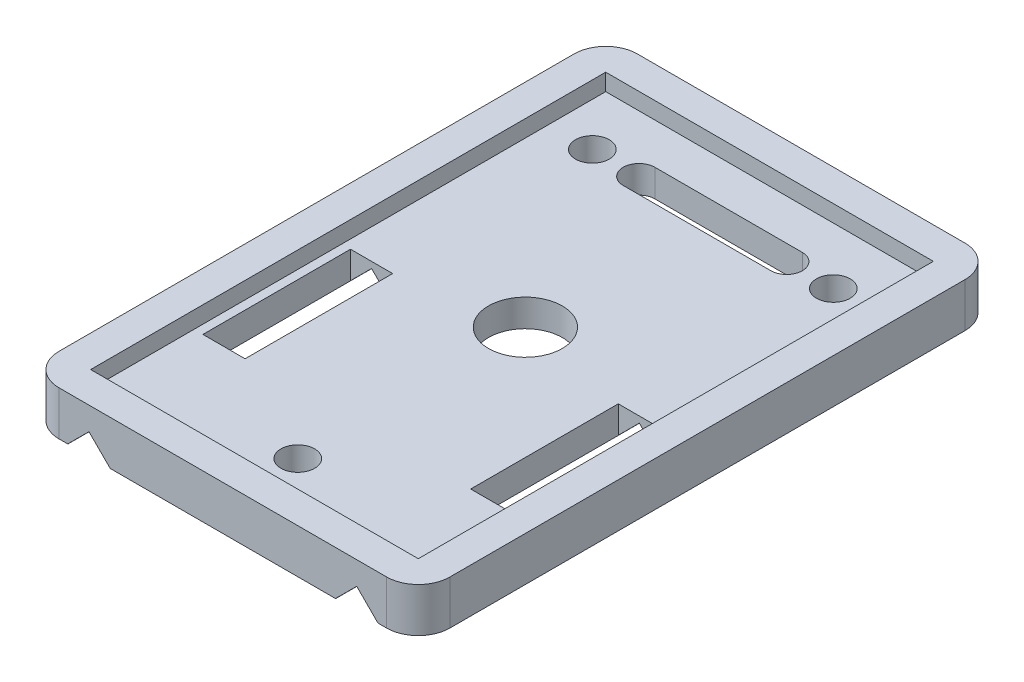
from build123d import *

# Parameters (mm, degrees)
BOSS_EXTRUDE1_DEPTH     = 4.2
CUT_EXTRUDE4_DEPTH      = 62.783185415
CUT_EXTRUDE4_DEPTH_BACK = 62.783185415
SKETCH2_R               = 1.6
SKETCH3_W               = 4
SKETCH3_H               = 14
CUT_EXTRUDE5_DEPTH      = 62.783185415
SKETCH6_W               = 31.08
SKETCH6_H               = 48.86
CUT_EXTRUDE6_DEPTH      = 1.6
CUT_EXTRUDE7_DEPTH      = 65.562744675
CUT_EXTRUDE7_DEPTH_BACK = 35
CUT_EXTRUDE8_DEPTH      = 62.695072737
CUT_EXTRUDE8_DEPTH_BACK = 62.695072737
SKETCH9_R               = 3.5


with BuildPart() as part:
    # Sketch1 → Boss-Extrude1 (new body)
    with BuildSketch(Plane(origin=(0, 0, 0), x_dir=(1, 0, 0), z_dir=(0, 1, 0))):
        with BuildLine():
            Line((-3.3, -0.3), (-3.3, 48.56))
            ThreePointArc((-3.3, 48.56), (-2.421320344, 50.681320344), (-0.3, 51.56))
            Line((-0.3, 51.56), (30.78, 51.56))
            ThreePointArc((30.78, 51.56), (32.901320344, 50.681320344), (33.78, 48.56))
            Line((33.78, 48.56), (33.78, -0.3))
            ThreePointArc((33.78, -0.3), (32.901320344, -2.421320344), (30.78, -3.3))
            Line((30.78, -3.3), (-0.3, -3.3))
            ThreePointArc((-0.3, -3.3), (-2.421320344, -2.421320344), (-3.3, -0.3))
        make_face()
    extrude(amount=BOSS_EXTRUDE1_DEPTH)

    # Sketch2 → Cut-Extrude4 (cut, two sides: drawn at the far end of the back side and taken through both)
    with BuildSketch(Plane(origin=(0, 0, 0), x_dir=(1, 0, 0), z_dir=(0, 1, 0)).offset(-CUT_EXTRUDE4_DEPTH_BACK)):
        with Locations(Location((3.81, 43.18, 0), (0, 0, 270))):
            Circle(SKETCH2_R)
        with Locations(Location((26.67, 43.18, 0), (0, 0, 270))):
            Circle(SKETCH2_R)
        with Locations(Location((15.24, 3.81, 0), (0, 0, 270))):
            Circle(SKETCH2_R)
    extrude(amount=CUT_EXTRUDE4_DEPTH + CUT_EXTRUDE4_DEPTH_BACK, mode=Mode.SUBTRACT)

    # Sketch3 → Cut-Extrude5 (cut, through all)
    with BuildSketch(Plane(origin=(0, 0, 0), x_dir=(1, 0, 0), z_dir=(0, 1, 0))):
        with Locations((2.54, 16.51)):
            Rectangle(SKETCH3_W, SKETCH3_H)
        with Locations((27.94, 16.51)):
            Rectangle(SKETCH3_W, SKETCH3_H)
    extrude(amount=CUT_EXTRUDE5_DEPTH, mode=Mode.SUBTRACT)

    # Sketch6 → Cut-Extrude6 (cut)
    with BuildSketch(Plane(origin=(0, 4.2, 0), x_dir=(1, 0, 0), z_dir=(0, 1, 0))):
        with Locations((15.24, 24.13)):
            Rectangle(SKETCH6_W, SKETCH6_H)
    extrude(amount=-CUT_EXTRUDE6_DEPTH, mode=Mode.SUBTRACT)

    # Sketch8 → Cut-Extrude7 (cut, two sides: drawn at the far end of the back side and taken through both)
    with BuildSketch(Plane.XY.offset(3.3).offset(-CUT_EXTRUDE7_DEPTH_BACK)):
        with BuildLine():
            ThreePointArc((1.74, 0), (1.542515791, 0.67088902), (1.832893219, 1.307106781))
            Line((1.832893219, 1.307106781), (0.54, 0.014213562))
            Line((0.54, 0.014213562), (0.54, 0))
            Line((0.54, 0), (1.74, 0))
        make_face()
        with BuildLine():
            ThreePointArc((1.832893219, 1.307106781), (2.54, 1.6), (3.247106781, 1.307106781))
            Line((3.247106781, 1.307106781), (2.54, 2.014213562))
            Line((2.54, 2.014213562), (1.832893219, 1.307106781))
        make_face()
        with BuildLine():
            ThreePointArc((3.54, 0.6), (3.463879533, 0.982683432), (3.247106781, 1.307106781))
            ThreePointArc((3.247106781, 1.307106781), (2.54, 1.6), (1.832893219, 1.307106781))
            ThreePointArc((1.832893219, 1.307106781), (1.542515791, 0.67088902), (1.74, 0))
            Line((1.74, 0), (3.34, 0))
            ThreePointArc((3.34, 0), (3.488683298, 0.283772234), (3.54, 0.6))
        make_face()
        with BuildLine():
            ThreePointArc((1.74, 0), (2.54, -0.4), (3.34, 0))
            Line((3.34, 0), (1.74, 0))
        make_face()
        with BuildLine():
            Line((4.54, 0), (4.54, 0.014213562))
            Line((4.54, 0.014213562), (3.247106781, 1.307106781))
            ThreePointArc((3.247106781, 1.307106781), (3.463879533, 0.982683432), (3.54, 0.6))
            ThreePointArc((3.54, 0.6), (3.488683298, 0.283772234), (3.34, 0))
            Line((3.34, 0), (4.54, 0))
        make_face()
        with BuildLine():
            Line((29.94, 0.014213562), (28.647106781, 1.307106781))
            ThreePointArc((28.647106781, 1.307106781), (28.863879533, 0.982683432), (28.94, 0.6))
            ThreePointArc((28.94, 0.6), (28.888683298, 0.283772234), (28.74, 0))
            Line((28.74, 0), (29.94, 0))
            Line((29.94, 0), (29.94, 0.014213562))
        make_face()
        with BuildLine():
            Line((28.647106781, 1.307106781), (27.94, 2.014213562))
            Line((27.94, 2.014213562), (27.23289323, 1.307106792))
            ThreePointArc((27.23289323, 1.307106792), (27.940000008, 1.6), (28.647106781, 1.307106781))
        make_face()
        with BuildLine():
            ThreePointArc((28.94, 0.6), (28.863879533, 0.982683432), (28.647106781, 1.307106781))
            ThreePointArc((28.647106781, 1.307106781), (27.940000008, 1.6), (27.23289323, 1.307106792))
            ThreePointArc((27.23289323, 1.307106792), (26.942515792, 0.670889028), (27.14, 0))
            Line((27.14, 0), (28.74, 0))
            ThreePointArc((28.74, 0), (28.888683298, 0.283772234), (28.94, 0.6))
        make_face()
        with BuildLine():
            Line((28.74, 0), (27.14, 0))
            ThreePointArc((27.14, 0), (27.94, -0.4), (28.74, 0))
        make_face()
        with BuildLine():
            ThreePointArc((27.14, 0), (26.942515792, 0.670889028), (27.23289323, 1.307106792))
            Line((27.23289323, 1.307106792), (25.94, 0.014213562))
            Line((25.94, 0.014213562), (25.94, 0))
            Line((25.94, 0), (27.14, 0))
        make_face()
    extrude(amount=CUT_EXTRUDE7_DEPTH + CUT_EXTRUDE7_DEPTH_BACK, mode=Mode.SUBTRACT)

    # Sketch9 → Cut-Extrude8 (cut, two sides: drawn at the far end of the back side and taken through both)
    with BuildSketch(Plane(origin=(0, 2.6, 0), x_dir=(1, 0, 0), z_dir=(0, 1, 0)).offset(-CUT_EXTRUDE8_DEPTH_BACK)):
        with Locations(Location((15.24, 25.4, 0), (0, 0, 270))):
            Circle(SKETCH9_R)
        with BuildLine():
            Line((8.24, 44.68), (22.24, 44.68))
            ThreePointArc((22.24, 44.68), (23.74, 43.18), (22.24, 41.68))
            Line((22.24, 41.68), (8.24, 41.68))
            ThreePointArc((8.24, 41.68), (6.74, 43.18), (8.24, 44.68))
        make_face()
    extrude(amount=CUT_EXTRUDE8_DEPTH + CUT_EXTRUDE8_DEPTH_BACK, mode=Mode.SUBTRACT)


solid = part.part
